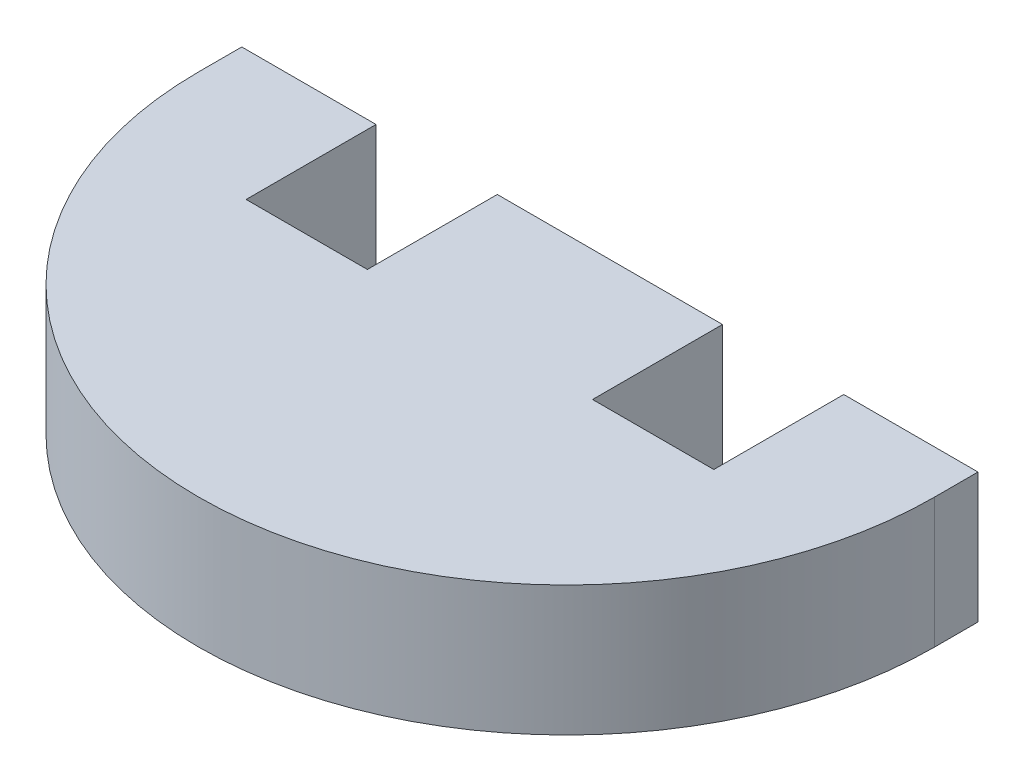
from build123d import *

# Parameters (mm, degrees)
BOSS_EXTRUDE1_DEPTH = 3
SKETCH2_W           = 2.8
SKETCH2_H           = 3
CUT_EXTRUDE1_DEPTH  = 13.389511693


with BuildPart() as part:
    # Sketch1 → Boss-Extrude1 (new body)
    with BuildSketch(Plane(origin=(0, 0, 0), x_dir=(1, 0, 0), z_dir=(0, 1, 0))):
        with BuildLine():
            Line((-8.5, 0), (-8.5, 1))
            Line((-8.5, 1), (8.5, 1))
            Line((8.5, 1), (8.5, 0))
            ThreePointArc((8.5, 0), (0, -8.5), (-8.5, 0))
        make_face()
    extrude(amount=BOSS_EXTRUDE1_DEPTH)

    # Sketch2 → Cut-Extrude1 (cut, through all)
    with BuildSketch(Plane(origin=(0, 3, 0), x_dir=(1, 0, 0), z_dir=(0, 1, 0))):
        with Locations((-4, -0.5)):
            Rectangle(SKETCH2_W, SKETCH2_H)
        with Locations((4, -0.5)):
            Rectangle(SKETCH2_W, SKETCH2_H)
    extrude(amount=-CUT_EXTRUDE1_DEPTH, mode=Mode.SUBTRACT)


solid = part.part
